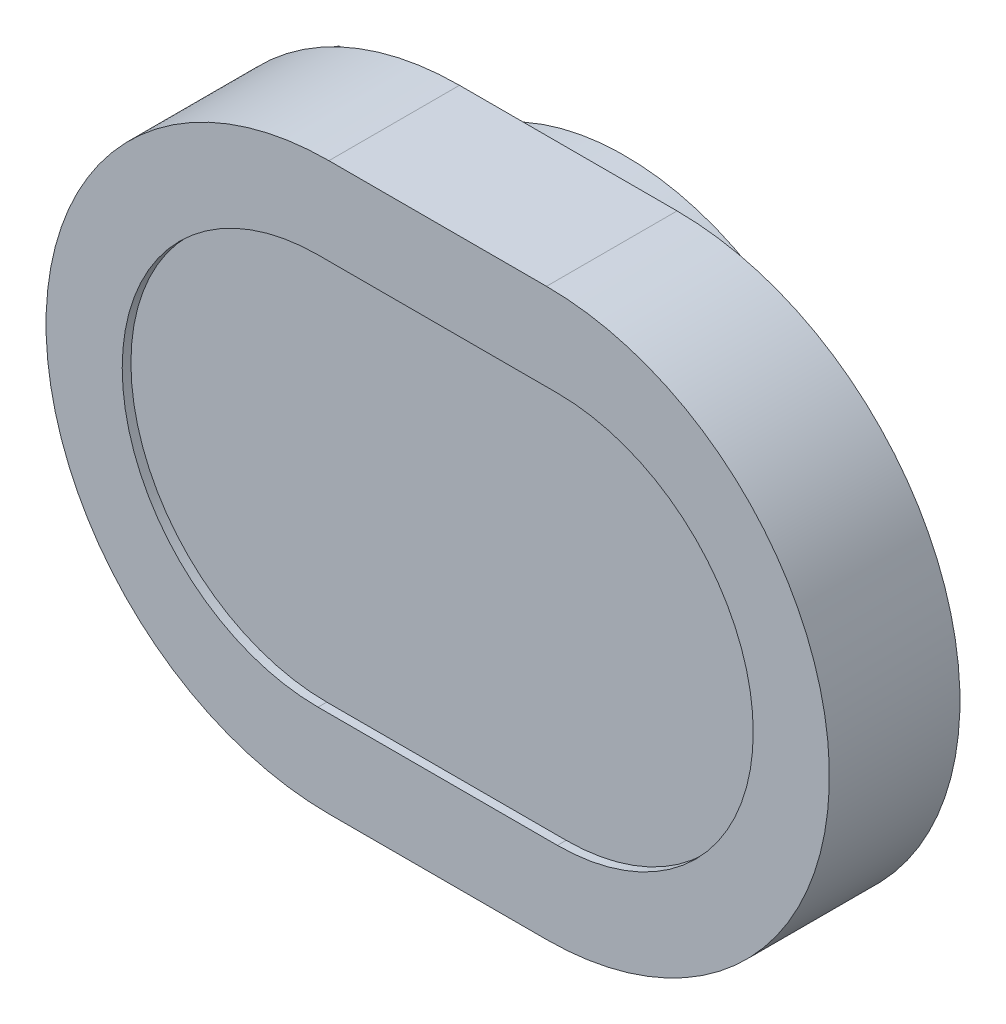
from build123d import *

# Parameters (mm, degrees)
SKETCH_1_R      = 5.7
EXTRUDE_1_DEPTH = 1.3
EXTRUDE_2_DEPTH = 2.8
EXTRUDE_3_DEPTH = 0.2
EXTRUDE_4_DEPTH = 0.4


with BuildPart() as part:
    # Эскиз1 → Бобышка-Вытянуть1 (new body)
    with BuildSketch(Plane.XY):
        Circle(SKETCH_1_R)
    extrude(amount=EXTRUDE_1_DEPTH)

    # Эскиз2 → Бобышка-Вытянуть2 (add)
    with BuildSketch(Plane.XY.offset(1.3)):
        with BuildLine():
            Line((-2.5, 6.5), (2.5, 6.5))
            ThreePointArc((2.5, 6.5), (9, 0), (2.5, -6.5))
            Line((2.5, -6.5), (-2.5, -6.5))
            ThreePointArc((-2.5, -6.5), (-9, 0), (-2.5, 6.5))
        make_face()
    extrude(amount=EXTRUDE_2_DEPTH)

    # Эскиз3 → Бобышка-Вытянуть3 (add)
    with BuildSketch(Plane.XY.offset(4.1)):
        with BuildLine():
            Line((-2.5, 6.5), (2.5, 6.5))
            ThreePointArc((2.5, 6.5), (9, 0), (2.5, -6.5))
            Line((2.5, -6.5), (-2.5, -6.5))
            ThreePointArc((-2.5, -6.5), (-9, 0), (-2.5, 6.5))
        make_face()
        with BuildLine():
            Line((-2.75, 4.5), (2.75, 4.5))
            ThreePointArc((2.75, 4.5), (7.25, 0), (2.75, -4.5))
            Line((2.75, -4.5), (-2.75, -4.5))
            ThreePointArc((-2.75, -4.5), (-7.25, 0), (-2.75, 4.5))
        make_face(mode=Mode.SUBTRACT)
    extrude(amount=EXTRUDE_3_DEPTH)

    # Эскиз4 → Бобышка-Вытянуть4 (add)
    with BuildSketch(Plane(origin=(0, 0, 1.3), x_dir=(-1, 0, 0), z_dir=(0, 0, -1))):
        with BuildLine():
            Line((5.355682571, 2.5), (8.331941275, 2.5))
            ThreePointArc((8.331941275, 2.5), (7.241539509, 4.216555717), (5.664101615, 5.5))
            Line((5.664101615, 5.5), (2.164101615, 5.5))
            ThreePointArc((2.164101615, 5.5), (4.04805985, 4.306570242), (5.355682571, 2.5))
        make_face()
        with BuildLine():
            Line((5.355682571, -2.5), (8.331941275, -2.5))
            ThreePointArc((8.331941275, -2.5), (7.241539509, -4.216555717), (5.664101615, -5.5))
            Line((5.664101615, -5.5), (2.164101615, -5.5))
            ThreePointArc((2.164101615, -5.5), (4.04805985, -4.306570242), (5.355682571, -2.5))
        make_face()
    extrude(amount=EXTRUDE_4_DEPTH)


solid = part.part
